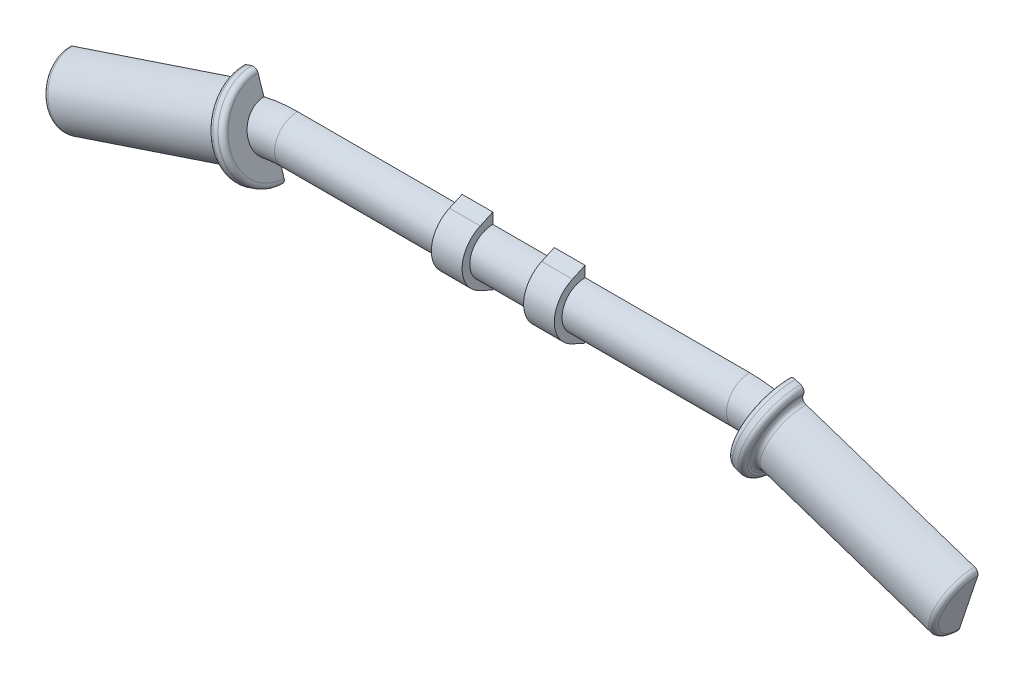
from build123d import *

# Parameters (mm, degrees)
SKETCH1_W            = 6.35
SKETCH1_H            = 6.35
BOSS_EXTRUDE1_DEPTH  = 4.7625
SKETCH3_R            = 1.5875
BOSS_EXTRUDE2_DEPTH  = 1.5875
BOSS_EXTRUDE3_START  = -1.5875
SKETCH4_R            = 1.5875
BOSS_EXTRUDE3_DEPTH  = 1.5875
SKETCH5_R            = 1.190625
BOSS_EXTRUDE4_START  = -8.89
SKETCH7_R            = 1.74625
BOSS_EXTRUDE4_DEPTH  = 9.68375
SKETCH8_R            = 2.38125
BOSS_EXTRUDE5_DEPTH  = 0.79375
FILLET2_R            = 0.254
FILLET3_R            = 0.254
FILLET4_R            = 0.254
FILLET2_OF_MIRROR3_R = 0.254
FILLET3_OF_MIRROR3_R = 0.254
FILLET4_OF_MIRROR3_R = 0.254
SKETCH9_W            = 52.511518924
SKETCH9_H            = 9.759118081
CUT_EXTRUDE1_DEPTH   = 27.610644864


with BuildPart() as part:
    # Sketch1 → Boss-Extrude1 (new body)
    with BuildSketch(Plane.XY):
        with Locations((1.55575, 0.635)):
            Rectangle(SKETCH1_W, SKETCH1_H)
    extrude(amount=BOSS_EXTRUDE1_DEPTH)

    # Sketch3 → Boss-Extrude2 (add)
    with BuildSketch(Plane(origin=(4.73075, 0, 0), x_dir=(0, 0, -1), z_dir=(1, 0, 0))):
        with Locations((-7.9375, 0.635)):
            Circle(SKETCH3_R)
        with BuildLine():
            Line((-4.7625, -2.54), (-4.7625, 3.81))
            Line((-4.7625, 3.81), (-8.590657552, 2.081907552))
            ThreePointArc((-8.590657552, 2.081907552), (-7.076318069, 1.968612362), (-6.35, 0.635))
            ThreePointArc((-6.35, 0.635), (-7.076318069, -0.698612362), (-8.590657552, -0.811907552))
            Line((-8.590657552, -0.811907552), (-4.7625, -2.54))
        make_face()
    extrude(amount=-BOSS_EXTRUDE2_DEPTH)

    # Sketch4 → Boss-Extrude3 (add)
    with BuildSketch(Plane.ZY.offset(1.61925).offset(BOSS_EXTRUDE3_START)):
        with BuildLine():
            Line((4.7625, -2.54), (8.590657552, -0.811907552))
            ThreePointArc((8.590657552, -0.811907552), (6.35, 0.635), (8.590657552, 2.081907552))
            Line((8.590657552, 2.081907552), (4.7625, 3.81))
            Line((4.7625, 3.81), (4.7625, -2.54))
        make_face()
        with Locations((7.9375, 0.635)):
            Circle(SKETCH4_R)
    extrude(amount=BOSS_EXTRUDE3_DEPTH)

    # Sweep1: sweep along a path in Sketch6
    with BuildLine(Plane.XY.offset(7.9375)) as sweep1_path:
        Line((-1.61925, 0.635), (4.73075, 0.635))
        Line((4.73075, 0.635), (13.225286858, 0.635))
        ThreePointArc((13.225286858, 0.635), (14.242444101, 0.553005356), (15.233333172, 0.309138943))
        Line((15.233333172, 0.309138943), (23.78075, -2.54))
    # Sketch5 → Sweep1 (sweep)
    with BuildSketch(Plane.ZY.offset(1.61925)):
        with Locations((7.9375, 0.635)):
            Circle(SKETCH5_R)
    sweep1 = sweep(path=sweep1_path.line)

    # Mirror1: Sweep1 across plane
    add(sweep1.mirror(Plane.ZY.offset(-1.55575)))

    # Sketch7 → Boss-Extrude4 (add)
    with BuildSketch(Plane(origin=(22.164675, -7.388225, 0), x_dir=(0, 0, -1), z_dir=(0.9486832980505139, -0.31622776601683794, 0)).offset(BOSS_EXTRUDE4_START)):
        with Locations(Location((-7.9375, 5.11047787, 0), (0, 0, 90))):
            Circle(SKETCH7_R)
    boss_extrude4 = extrude(amount=BOSS_EXTRUDE4_DEPTH)

    # Sketch8 → Boss-Extrude5 (add)
    with BuildSketch(Plane(origin=(13.73088048, -4.57696016, 0), x_dir=(0, 0, 1), z_dir=(-0.9486832980505139, 0.316227766016838, 0))):
        with Locations(Location((7.9375, 5.11047787, 0), (0, 0, 90))):
            Circle(SKETCH8_R)
    boss_extrude5 = extrude(amount=BOSS_EXTRUDE5_DEPTH)

    # Fillet2
    fillet2_edges = [part.edges().sort_by_distance(p)[0] for p in [
        (23.981554631, -4.447643999, 7.9375),
    ]]
    fillet(fillet2_edges, radius=FILLET2_R)

    # Fillet3
    fillet3_edges = [part.edges().sort_by_distance(p)[0] for p in [
        (14.794742744, -1.385373369, 7.9375),
    ]]
    fillet(fillet3_edges, radius=FILLET3_R)

    # Fillet4
    fillet4_edges = [part.edges().sort_by_distance(p)[0] for p in [
        (13.840920745, -1.736781474, 7.9375),
        (14.593938113, -1.987787264, 7.9375),
    ]]
    fillet(fillet4_edges, radius=FILLET4_R)

    # Mirror3: Boss-Extrude4, Boss-Extrude5 across plane
    add(boss_extrude4.mirror(Plane.ZY.offset(-1.55575)))
    add(boss_extrude5.mirror(Plane.ZY.offset(-1.55575)))

    # Fillet2 of Mirror3
    fillet2_of_mirror3_edges = [part.edges().sort_by_distance(p)[0] for p in [
        (-20.870054631, -4.447643999, 7.9375),
    ]]
    fillet(fillet2_of_mirror3_edges, radius=FILLET2_OF_MIRROR3_R)

    # Fillet3 of Mirror3
    fillet3_of_mirror3_edges = [part.edges().sort_by_distance(p)[0] for p in [
        (-11.683242744, -1.385373369, 7.9375),
    ]]
    fillet(fillet3_of_mirror3_edges, radius=FILLET3_OF_MIRROR3_R)

    # Fillet4 of Mirror3
    fillet4_of_mirror3_edges = [part.edges().sort_by_distance(p)[0] for p in [
        (-10.729420745, -1.736781474, 7.9375),
        (-11.482438113, -1.987787264, 7.9375),
    ]]
    fillet(fillet4_of_mirror3_edges, radius=FILLET4_OF_MIRROR3_R)

    # Sketch9 → Cut-Extrude1 (cut, through all)
    with BuildSketch(Plane.XY.offset(7.9375)):
        with Locations((1.780183147, -0.320056159)):
            Rectangle(SKETCH9_W, SKETCH9_H)
    extrude(amount=-CUT_EXTRUDE1_DEPTH, mode=Mode.SUBTRACT)


solid = part.part
